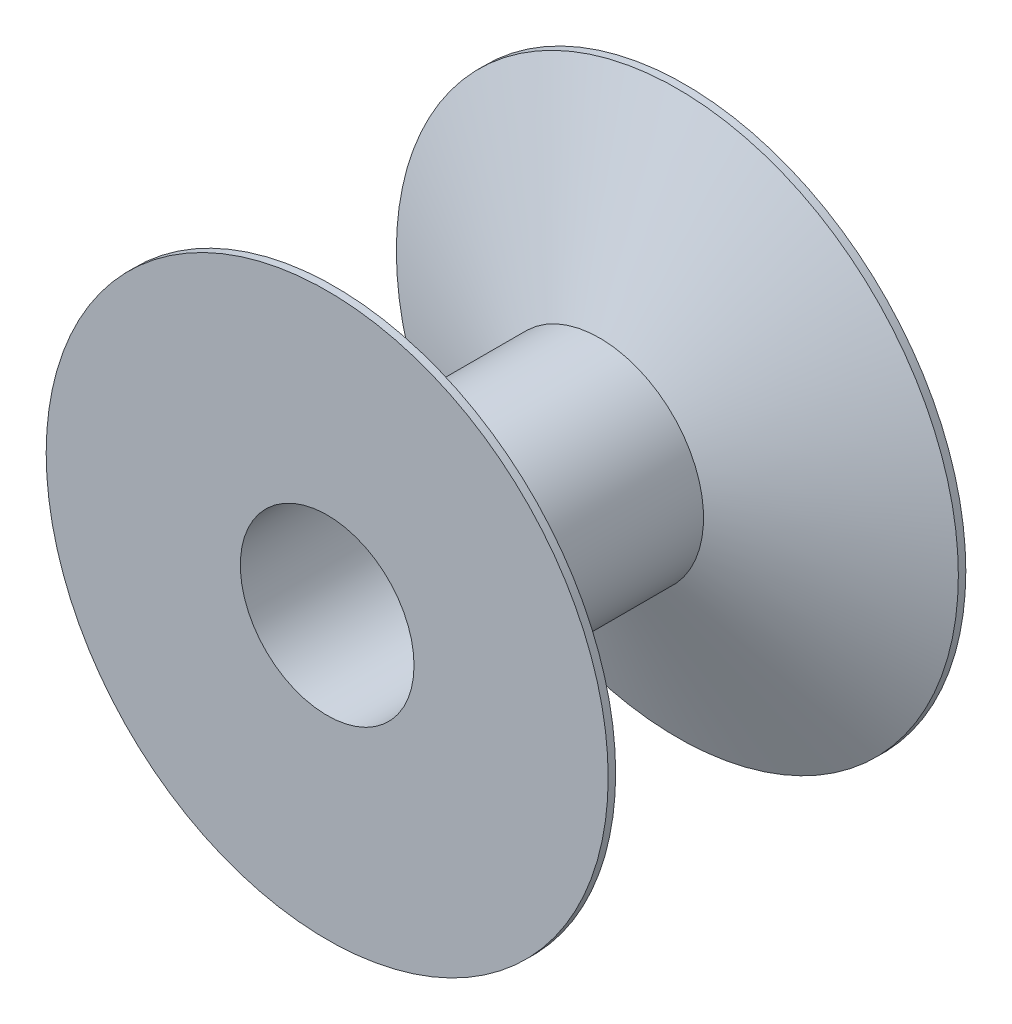
from build123d import *

# Parameters (mm, degrees)
SKETCH_1_R          = 6.1
SKETCH_1_R_2        = 5.1
EXTRUDE_1_DEPTH     = 11
SKETCH_2_R          = 17.5
SKETCH_2_R_2        = 5.1
EXTRUDE_2_DEPTH     = 5
SKETCH_4_OUTSIDE_W  = 47.754
SKETCH_4_OUTSIDE_H  = 47.754
SKETCH_4_OUTSIDE_R  = 16.5
CUT_EXTRUDE_1_DEPTH = 33.457664734


with BuildPart() as part:
    # 스케치1 → 보스-돌출1 (new body)
    with BuildSketch(Plane.XY):
        Circle(SKETCH_1_R)
        Circle(SKETCH_1_R_2, mode=Mode.SUBTRACT)
    extrude(amount=EXTRUDE_1_DEPTH)

    # 스케치2 → 보스-돌출2 (add)
    with BuildSketch(Plane.XY.offset(11)):
        Circle(SKETCH_2_R)
        Circle(SKETCH_2_R_2, mode=Mode.SUBTRACT)
    extrude_2 = extrude(amount=EXTRUDE_2_DEPTH)

    # 대칭 복사1: 보스-돌출2 across plane
    add(extrude_2.mirror(Plane.XY.offset(5.5)))

    # 스케치3 → 컷-회전1 (revolve, cut)
    with BuildSketch(Plane(origin=(0, 0, 0), x_dir=(1, 0, 0), z_dir=(0, 1, 0))):
        Polygon((-17.5, 5), (-6.1, 0), (-17.5, 0), align=None)
        Polygon((-17.5, -11), (-17.5, -16), (-6.1, -11), align=None)
    revolve(axis=Axis((0, 0, -9.433987915), (0, 0, 1)), mode=Mode.SUBTRACT)

    # 스케치4 outside → 컷-돌출1 (cut, through all)
    with BuildSketch(Plane.XY.offset(16)):
        Rectangle(SKETCH_4_OUTSIDE_W, SKETCH_4_OUTSIDE_H)
        Circle(SKETCH_4_OUTSIDE_R, mode=Mode.SUBTRACT)
    extrude(amount=-CUT_EXTRUDE_1_DEPTH, mode=Mode.SUBTRACT)


solid = part.part
